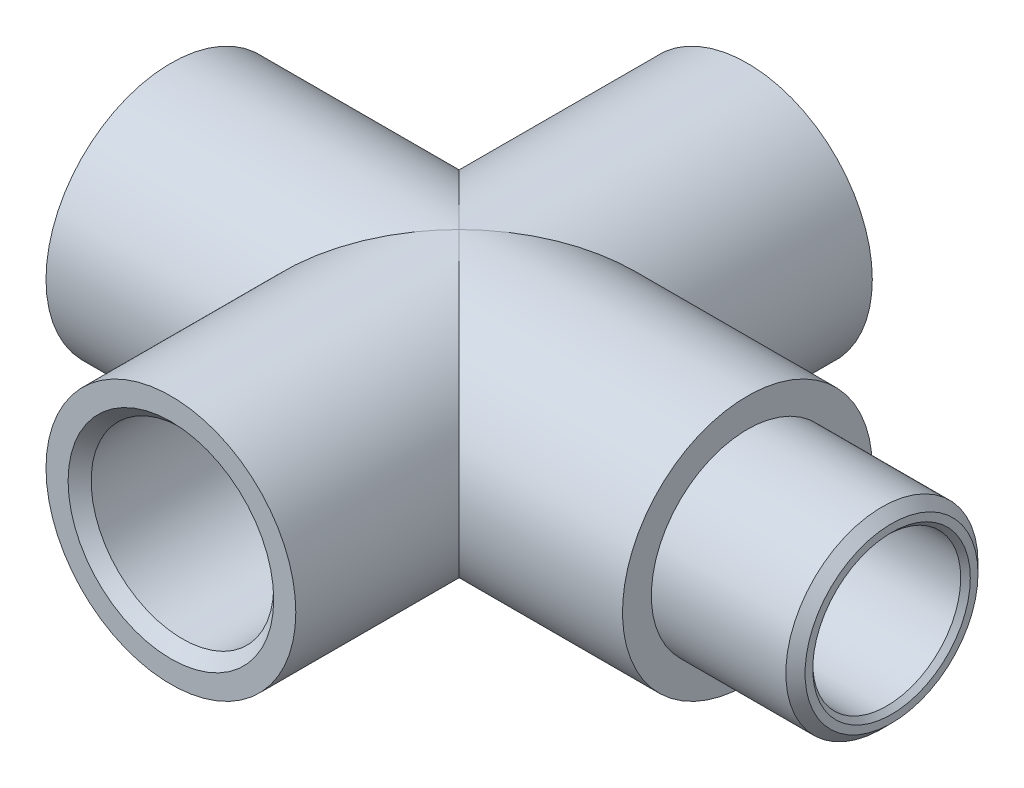
from build123d import *

# Parameters (mm, degrees)
SKETCH_1_R               = 13
EXTRUDE_1_DEPTH          = 30
SKETCH_2_R               = 13
EXTRUDE_2_DEPTH          = 45
SKETCH_3_R               = 13
SKETCH_3_R_2             = 10
CUT_EXTRUDE_1_DEPTH      = 15
SKETCH_4_R               = 9.5
CUT_EXTRUDE_2_DEPTH      = 90
CUT_EXTRUDE_3_REACH      = 97.755
CUT_EXTRUDE_3_END_RADIUS = 9.5
SKETCH_5_R               = 7.7
CUT_EXTRUDE_4_REACH      = 97.755
CUT_EXTRUDE_4_END_RADIUS = 9.5
SKETCH_6_R               = 9.5
CUT_EXTRUDE_START        = -15
SKETCH_7_R               = 13
CUT_EXTRUDE_5_DEPTH      = 15
CHAMFER_1_SIZE           = 1.2
CHAMFER_2_SIZE           = 1
CHAMFER_3_SIZE           = 0.5


with BuildPart() as part:
    # 草图1 → 拉伸1 (new, symmetric)
    with BuildSketch(Plane.XY):
        Circle(SKETCH_1_R)
    extrude(amount=EXTRUDE_1_DEPTH, both=True)

    # 草图2 → 拉伸2 (add, symmetric)
    with BuildSketch(Plane(origin=(0, 0, 0), x_dir=(0, 0, -1), z_dir=(1, 0, 0))):
        with Locations(Location((0, 0, 0), (0, 0, 270))):
            Circle(SKETCH_2_R)
    extrude(amount=EXTRUDE_2_DEPTH, both=True)

    # 草图3 → 切除-拉伸1 (cut)
    with BuildSketch(Plane(origin=(45, 0, 0), x_dir=(0, 0, -1), z_dir=(1, 0, 0))):
        with Locations(Location((0, 0, 0), (0, 0, 270))):
            Circle(SKETCH_3_R)
        Circle(SKETCH_3_R_2, mode=Mode.SUBTRACT)
    extrude(amount=-CUT_EXTRUDE_1_DEPTH, mode=Mode.SUBTRACT)

    # 草图4 → 切除-拉伸2 (cut)
    with BuildSketch(Plane.XY.offset(30)):
        Circle(SKETCH_4_R)
    extrude(amount=-CUT_EXTRUDE_2_DEPTH, mode=Mode.SUBTRACT)

    # 切除-拉伸3: up to this cylinder (the profile starts outside it)
    cut_extrude_3_end = Plane(origin=(0, 0, 0), z_dir=(0, 0, 1)) * Cylinder(CUT_EXTRUDE_3_END_RADIUS, 215.51, mode=Mode.PRIVATE)
    # 草图5 → 切除-拉伸3 (cut, up to the surface)
    with BuildSketch(Plane(origin=(45, 0, 0), x_dir=(0, 0, -1), z_dir=(1, 0, 0)), mode=Mode.PRIVATE) as cut_extrude_3_sk1:
        Circle(SKETCH_5_R)
    cut_extrude_3_tool1 = extrude(cut_extrude_3_sk1.sketch, amount=-CUT_EXTRUDE_3_REACH, mode=Mode.PRIVATE) - cut_extrude_3_end
    add(cut_extrude_3_tool1.solids().sort_by_distance((45, 0, 0))[0], mode=Mode.SUBTRACT)

    # 切除-拉伸4: up to this cylinder (the profile starts outside it)
    cut_extrude_4_end = Plane(origin=(0, 0, 0), z_dir=(0, 0, 1)) * Cylinder(CUT_EXTRUDE_4_END_RADIUS, 215.51, mode=Mode.PRIVATE)
    # 草图6 → 切除-拉伸4 (cut, up to the surface)
    with BuildSketch(Plane.ZY.offset(45), mode=Mode.PRIVATE) as cut_extrude_4_sk1:
        Circle(SKETCH_6_R)
    cut_extrude_4_tool1 = extrude(cut_extrude_4_sk1.sketch, amount=-CUT_EXTRUDE_4_REACH, mode=Mode.PRIVATE) - cut_extrude_4_end
    add(cut_extrude_4_tool1.solids().sort_by_distance((-45, 0, 0))[0], mode=Mode.SUBTRACT)

    # 草图7 → 切除-拉伸5 (cut)
    with BuildSketch(Plane.ZY.offset(45).offset(CUT_EXTRUDE_START)):
        Circle(SKETCH_7_R)
    extrude(amount=CUT_EXTRUDE_5_DEPTH, mode=Mode.SUBTRACT)

    # 倒角1
    chamfer_1_edges = [part.edges().sort_by_distance(p)[0] for p in [
        (-9.5, 0, -30),
        (-9.5, 0, 30),
        (-30, 0, -9.5),
    ]]
    chamfer(chamfer_1_edges, length=CHAMFER_1_SIZE)

    # 倒角2
    chamfer_2_edges = [part.edges().sort_by_distance(p)[0] for p in [
        (45, 0, 10),
    ]]
    chamfer(chamfer_2_edges, length=CHAMFER_2_SIZE)

    # 倒角3
    chamfer_3_edges = [part.edges().sort_by_distance(p)[0] for p in [
        (45, 0, 7.7),
    ]]
    chamfer(chamfer_3_edges, length=CHAMFER_3_SIZE)


solid = part.part
